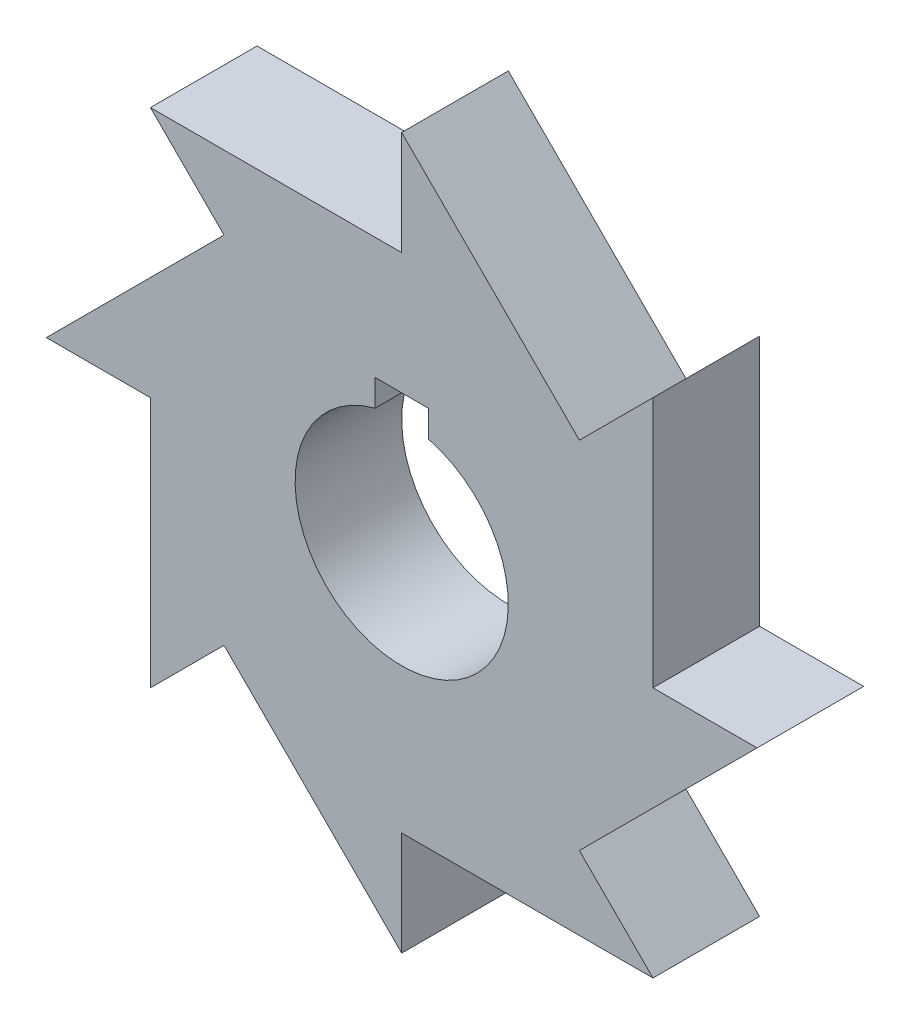
from build123d import *

# Parameters (mm, degrees)
BOSS_EXTRUDE1_DEPTH = 9.525


with BuildPart() as part:
    # Sketch1 → Boss-Extrude1 (new, symmetric)
    with BuildSketch(Plane.XY):
        Polygon((0, 63.5), (31.75, 31.75), (44.901280605, 44.901280605), (44.901280605, 0), (63.5, 0), (31.75, -31.75), (44.901280605, -44.901280605), (0, -44.901280605), (0, -63.5), (-31.75, -31.75), (-44.901280605, -44.901280605), (-44.901280605, 0), (-63.5, 0), (-31.75, 31.75), (-44.901280605, 44.901280605), (0, 44.901280605), align=None)
        with BuildLine():
            Line((-4.7625, 23.207583186), (4.7625, 23.207583186))
            Line((4.7625, 23.207583186), (4.7625, 18.445083186))
            ThreePointArc((4.7625, 18.445083186), (0, -19.05), (-4.7625, 18.445083186))
            Line((-4.7625, 18.445083186), (-4.7625, 23.207583186))
        make_face(mode=Mode.SUBTRACT)
    extrude(amount=BOSS_EXTRUDE1_DEPTH, both=True)


solid = part.part
